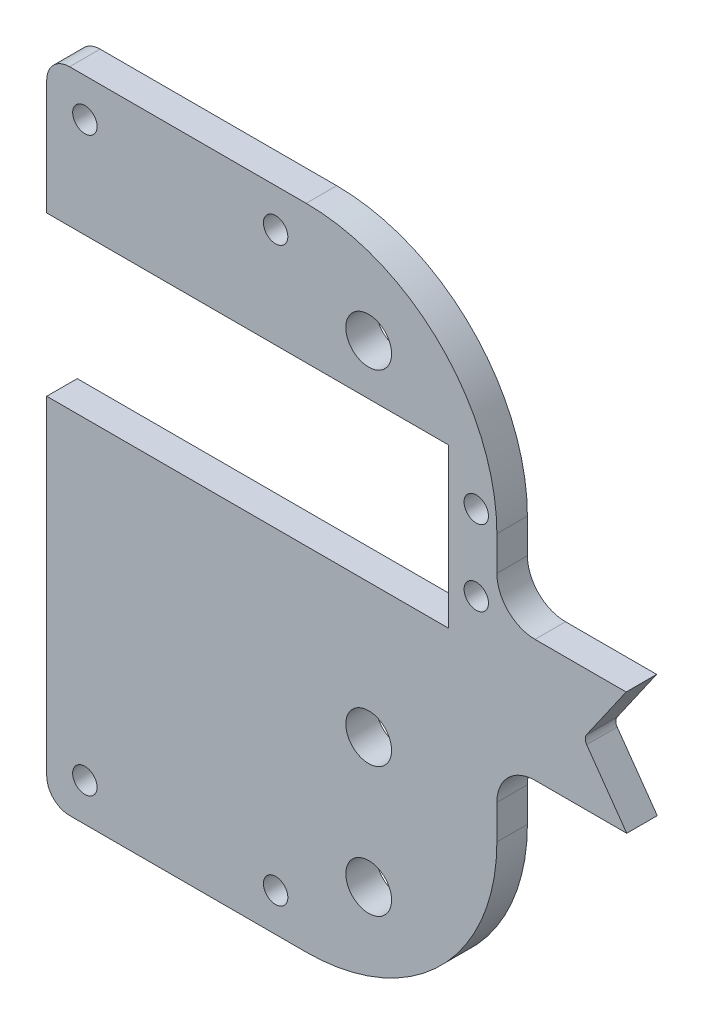
from build123d import *

# Parameters (mm, degrees)
SKETCH_1_R          = 3
SKETCH_1_R_2        = 1.6
EXTRUDE_1_DEPTH     = 4
FILLET_1_R          = 3
FILLET_2_R          = 25
SKETCH_2_R          = 1.6
CUT_EXTRUDE_1_DEPTH = 10
SKETCH_3_R          = 3
CUT_EXTRUDE_2_DEPTH = 10
EXTRUDE_2_DEPTH     = 4
FILLET_3_R          = 5
FILLET_4_R          = 1
SKETCH_5_R          = 1.6
CUT_EXTRUDE_3_DEPTH = 10


with BuildPart() as part:
    # ｽｹｯﾁ1 → ﾎﾞｽ - 押し出し1 (new body)
    with BuildSketch(Plane.XY):
        Polygon((-32, -10.4), (-32, -31), (27, -31), (27, 54), (-32, 54), (-32, 35.9), (20.65, 35.9), (20.65, 15.1), (-32, 15.1), (-32, 10.4), align=None)
        with Locations((10.2, -19.5)):
            Circle(SKETCH_1_R, mode=Mode.SUBTRACT)
        with Locations((24.3, 20.55)):
            Circle(SKETCH_1_R_2, mode=Mode.SUBTRACT)
        with Locations((24.3, 30.45)):
            Circle(SKETCH_1_R_2, mode=Mode.SUBTRACT)
        with Locations((10.2, 42.5)):
            Circle(SKETCH_1_R, mode=Mode.SUBTRACT)
    extrude(amount=EXTRUDE_1_DEPTH)

    # ﾌｨﾚｯﾄ1
    fillet_1_edges = [part.edges().sort_by_distance(p)[0] for p in [
        (-32, 54, 2),
        (-32, -31, 2),
    ]]
    fillet(fillet_1_edges, radius=FILLET_1_R)

    # ﾌｨﾚｯﾄ2
    fillet_2_edges = [part.edges().sort_by_distance(p)[0] for p in [
        (27, 54, 2),
        (27, -31, 2),
    ]]
    fillet(fillet_2_edges, radius=FILLET_2_R)

    # ｽｹｯﾁ2 → ｶｯﾄ - 押し出し1 (cut)
    with BuildSketch(Plane(origin=(0, 0, 0), x_dir=(-1, 0, 0), z_dir=(0, 0, -1))):
        with Locations((27, 49)):
            Circle(SKETCH_2_R)
        with Locations((27, -26)):
            Circle(SKETCH_2_R)
    extrude(amount=-CUT_EXTRUDE_1_DEPTH, mode=Mode.SUBTRACT)

    # ｽｹｯﾁ3 → ｶｯﾄ - 押し出し2 (cut)
    with BuildSketch(Plane(origin=(0, 0, 0), x_dir=(-1, 0, 0), z_dir=(0, 0, -1))):
        with Locations((-10.2, -2.5)):
            Circle(SKETCH_3_R)
    extrude(amount=-CUT_EXTRUDE_2_DEPTH, mode=Mode.SUBTRACT)

    # ｽｹｯﾁ4 → ﾎﾞｽ - 押し出し2 (add)
    with BuildSketch(Plane(origin=(0, 0, 0), x_dir=(-1, 0, 0), z_dir=(0, 0, -1))):
        Polygon((-27, 19.5), (-43.945270358, 19.5), (-38.364198183, 11.5), (-44.023561215, 3.5), (-27, 3.5), align=None)
    extrude(amount=-EXTRUDE_2_DEPTH)

    # ﾌｨﾚｯﾄ3
    fillet_3_edges = [part.edges().sort_by_distance(p)[0] for p in [
        (27, 19.5, 2),
        (27, 3.5, 2),
    ]]
    fillet(fillet_3_edges, radius=FILLET_3_R)

    # ﾌｨﾚｯﾄ4
    fillet_4_edges = [part.edges().sort_by_distance(p)[0] for p in [
        (38.364198183, 11.5, 2),
    ]]
    fillet(fillet_4_edges, radius=FILLET_4_R)

    # ｽｹｯﾁ5 → ｶｯﾄ - 押し出し3 (cut)
    with BuildSketch(Plane.XY.offset(4)):
        with Locations((-2, -26)):
            Circle(SKETCH_5_R)
        with Locations((-2, 49)):
            Circle(SKETCH_5_R)
    extrude(amount=-CUT_EXTRUDE_3_DEPTH, mode=Mode.SUBTRACT)


solid = part.part
